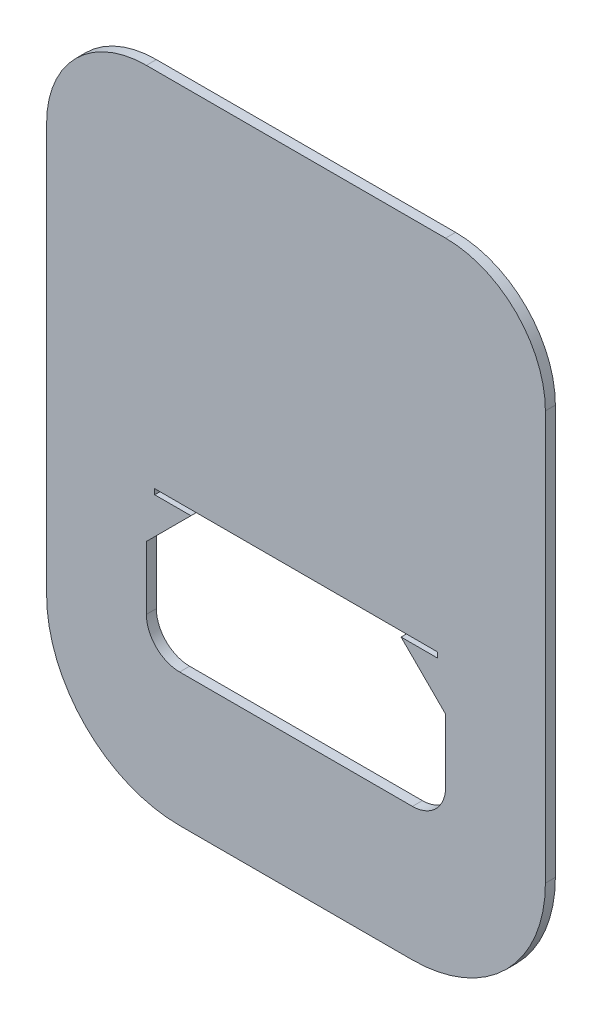
from build123d import *

# Parameters (mm, degrees)
BOSS_EXTRUDE1_DEPTH = 3
SKETCH2_W           = 90
SKETCH2_H           = 44
CUT_EXTRUDE1_DEPTH  = 10
FILLET1_R           = 10
CHAMFER1_SIZE       = 15
SKETCH3_W           = 85
SKETCH3_H           = 1.6
CUT_EXTRUDE2_DEPTH  = 10


with BuildPart() as part:
    # Sketch1 → Boss-Extrude1 (new body)
    with BuildSketch(Plane.XY):
        with BuildLine():
            Line((-45, 96.5), (45, 96.5))
            ThreePointArc((45, 96.5), (66.213203436, 87.713203436), (75, 66.5))
            Line((75, 66.5), (75, -56.5))
            ThreePointArc((75, -56.5), (63.284271247, -84.784271247), (35, -96.5))
            Line((35, -96.5), (0.5, -96.5))
            Line((0.5, -96.5), (-0.5, -96.5))
            Line((-0.5, -96.5), (-35, -96.5))
            ThreePointArc((-35, -96.5), (-63.284271247, -84.784271247), (-75, -56.5))
            Line((-75, -56.5), (-75, 66.5))
            ThreePointArc((-75, 66.5), (-66.213203436, 87.713203436), (-45, 96.5))
        make_face()
    extrude(amount=BOSS_EXTRUDE1_DEPTH)

    # Sketch2 → Cut-Extrude1 (cut)
    with BuildSketch(Plane.XY.offset(3)):
        with Locations((0, -34.5)):
            Rectangle(SKETCH2_W, SKETCH2_H)
    extrude(amount=-CUT_EXTRUDE1_DEPTH, mode=Mode.SUBTRACT)

    # Fillet1
    fillet1_edges = [part.edges().sort_by_distance(p)[0] for p in [
        (45, -56.5, 1.5),
        (-45, -56.5, 1.5),
    ]]
    fillet(fillet1_edges, radius=FILLET1_R)

    # Chamfer1
    chamfer1_edges = [part.edges().sort_by_distance(p)[0] for p in [
        (45, -12.5, 1.5),
        (-45, -12.5, 1.5),
    ]]
    chamfer(chamfer1_edges, length=CHAMFER1_SIZE)

    # Sketch3 → Cut-Extrude2 (cut)
    with BuildSketch(Plane(origin=(0, 0, 0), x_dir=(-1, 0, 0), z_dir=(0, 0, -1))):
        with Locations((0, -13.3)):
            Rectangle(SKETCH3_W, SKETCH3_H)
    extrude(amount=-CUT_EXTRUDE2_DEPTH, mode=Mode.SUBTRACT)


solid = part.part
